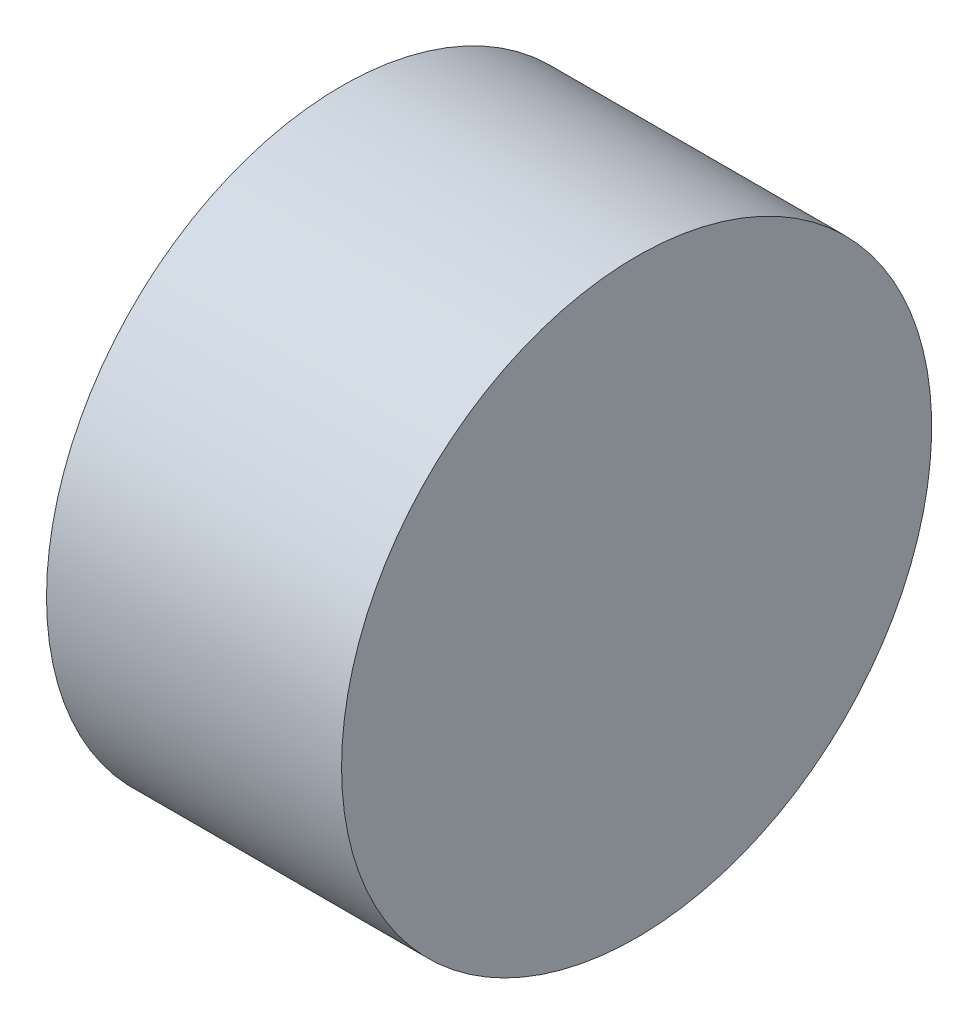
from build123d import *

# Parameters (mm, degrees)
SKETCH2_R           = 76.2
BOSS_EXTRUDE1_DEPTH = 38.1
SKETCH5_R           = 63.5
CUT_EXTRUDE2_DEPTH  = 51.6
SKETCH6_R           = 3.75
BOSS_EXTRUDE4_DEPTH = 12.7


with BuildPart() as part:
    # Sketch2 → Boss-Extrude1 (new, symmetric)
    with BuildSketch(Plane(origin=(0, 0, 0), x_dir=(0, 0, -1), z_dir=(1, 0, 0))):
        with Locations(Location((0, 0, 0), (0, 0, 180))):
            Circle(SKETCH2_R)
    extrude(amount=BOSS_EXTRUDE1_DEPTH, both=True)

    # Sketch5 → Cut-Extrude2 (cut)
    with BuildSketch(Plane.ZY.offset(38.1)):
        Circle(SKETCH5_R)
    extrude(amount=-CUT_EXTRUDE2_DEPTH, mode=Mode.SUBTRACT)


with BuildPart() as body_2:
    # Sketch6 → Boss-Extrude4 (new, symmetric)
    with BuildSketch(Plane(origin=(0, 0, 0), x_dir=(1, 0, 0), z_dir=(0, 1, 0))):
        with BuildLine():
            Line((13.5, 0), (13.5, 25))
            ThreePointArc((13.5, 25), (-11.5, 0), (13.5, -25))
            Line((13.5, -25), (13.5, 0))
        make_face()
        with Locations(Location((0, 0, 0), (0, 0, 270))):
            Circle(SKETCH6_R, mode=Mode.SUBTRACT)
    extrude(amount=BOSS_EXTRUDE4_DEPTH, both=True)


solid = Compound([part.part, body_2.part])
